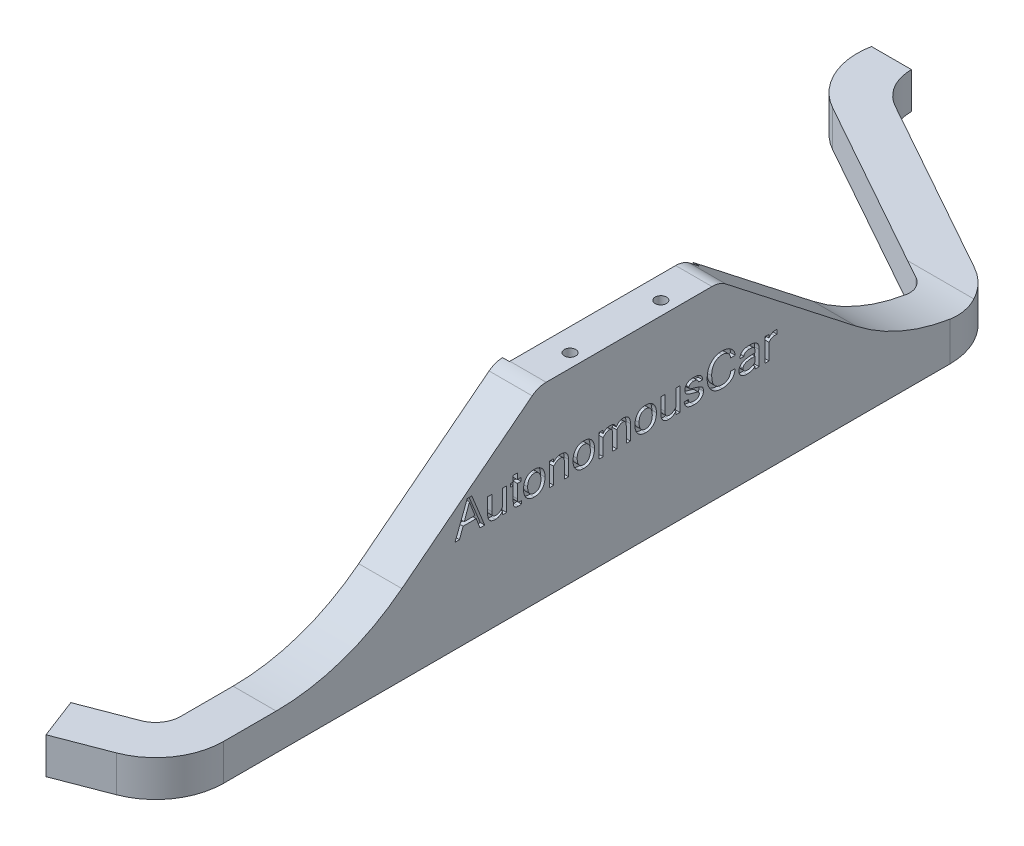
from build123d import *

# Parameters (mm, degrees)
BOSS_EXTRU_2_DEPTH      = 41
ENL_V_START             = -61.496999
ENL_V_MAT_EXTRU_1_DEPTH = 61.496999
ESQUISSE3_R             = 1.25
ENL_V_MAT_EXTRU_2_DEPTH = 5
ENL_V_MAT_EXTRU_4_REACH = 145.004
ESQUISSE5_W             = 1.5
ESQUISSE5_H             = 42
ESQUISSE4_R             = 1.25
ENL_V_MAT_EXTRU_3_DEPTH = 5
ENL_V_MAT_EXTRU_5_DEPTH = 1


with BuildPart() as part:
    # Esquisse1 → Boss.-Extru.2 (new body)
    with BuildSketch(Plane(origin=(0, 0, 0), x_dir=(1, 0, 0), z_dir=(0, 1, 0))):
        with BuildLine():
            Line((50.763559857, -98.740960781), (61.966654671, -94.440883272))
            ThreePointArc((61.966654671, -94.440883272), (64.531491929, -92.419022685), (65.5, -89.3))
            Line((65.5, -89.3), (65.5, 70.7))
            ThreePointArc((65.5, 70.7), (64.743593506, 73.483580545), (62.682428855, 75.501518035))
            Line((62.682428855, 75.501518035), (21.187286271, 98.683304924))
            ThreePointArc((21.187286271, 98.683304924), (14.89615211, 105.465379036), (13.780150118, 114.648485147))
            Line((13.780150118, 114.648485147), (22.592211018, 114.648485147))
            ThreePointArc((22.592211018, 114.648485147), (23.967495552, 109.587429612), (27.715067645, 105.918452357))
            Line((27.715067645, 105.918452357), (67.31571506, 83.795049185))
            ThreePointArc((67.31571506, 83.795049185), (72.937073199, 78.291583303), (75, 70.7))
            Line((75, 70.7), (75, -89.3))
            ThreePointArc((75, -89.3), (72.360609576, -97.8), (65.370882699, -103.31))
            Line((65.370882699, -103.31), (54.167787884, -107.610077509))
            Line((54.167787884, -107.610077509), (50.763559857, -98.740960781))
        make_face()
    extrude(amount=BOSS_EXTRU_2_DEPTH)

    # Esquisse2 → Enlèv. mat.-Extru.1 (cut)
    with BuildSketch(Plane(origin=(75, 0, 0), x_dir=(0, 0, -1), z_dir=(1, 0, 0)).offset(ENL_V_START)):
        with BuildLine():
            Line((-107.610077509, 8), (-77.729988546, 8))
            ThreePointArc((-77.729988546, 8), (-63.08996569, 10.448034936), (-50.042800053, 17.525789743))
            Line((-50.042800053, 17.525789743), (-21.322570174, 39.941578917))
            ThreePointArc((-21.322570174, 39.941578917), (-19.872885103, 40.727996118), (-18.246215897, 41))
            Line((-18.246215897, 41), (18.279747735, 41))
            ThreePointArc((18.279747735, 41), (19.906416941, 40.727996118), (21.356102012, 39.941578917))
            Line((21.356102012, 39.941578917), (50.076331892, 17.525789743))
            ThreePointArc((50.076331892, 17.525789743), (63.123497529, 10.448034936), (77.763520385, 8))
            Line((77.763520385, 8), (114.648485147, 8))
            Line((114.648485147, 8), (114.648485147, 51.491997176))
            Line((114.648485147, 51.491997176), (-107.610077509, 51.491997176))
            Line((-107.610077509, 51.491997176), (-107.610077509, 8))
        make_face()
    extrude(amount=ENL_V_MAT_EXTRU_1_DEPTH, mode=Mode.SUBTRACT)

    # Esquisse3 → Enlèv. mat.-Extru.2 (cut)
    with BuildSketch(Plane.XZ):
        with Locations(Location((72, 11.001514853, 0), (0, 0, 270))):
            Circle(ESQUISSE3_R)
        with Locations(Location((72, -39.078485147, 0), (0, 0, 270))):
            Circle(ESQUISSE3_R)
        with Locations(Location((63.03, 98.921514853, 0), (0, 0, 270))):
            Circle(ESQUISSE3_R)
        with Locations(Location((65.848788278, -79.175234258, 0), (0, 0, 270))):
            Circle(ESQUISSE3_R)
        with Locations(Location((26.642211018, -101.078485147, 0), (0, 0, 270))):
            Circle(ESQUISSE3_R)
        with Locations(Location((72, 61.081514853, 0), (0, 0, 270))):
            Circle(ESQUISSE3_R)
    extrude(amount=-ENL_V_MAT_EXTRU_2_DEPTH, mode=Mode.SUBTRACT)

    # Enlèv. mat.-Extru.4: up to this face of the body (flat: up to its plane)
    enl_v_mat_extru_4_end = Plane(part.part.faces().sort_by_distance((70.25, 41, -0.016765919))[0])
    # Esquisse5 → Enlèv. mat.-Extru.4 (cut, up to the picked face)
    with BuildSketch(Plane.XZ, mode=Mode.PRIVATE) as enl_v_mat_extru_4_sk1:
        with Locations((66.25, -2.648485147)):
            Rectangle(ESQUISSE5_W, ESQUISSE5_H)
    enl_v_mat_extru_4_tool1 = split(extrude(enl_v_mat_extru_4_sk1.sketch, amount=-ENL_V_MAT_EXTRU_4_REACH, mode=Mode.PRIVATE), bisect_by=enl_v_mat_extru_4_end, keep=Keep.BOTH, mode=Mode.PRIVATE)
    add(enl_v_mat_extru_4_tool1.solids().sort_by(Axis((66.25, 0, -2.648485), (0, 1, 0)))[0], mode=Mode.SUBTRACT)

    # Esquisse4 → Enlèv. mat.-Extru.3 (cut)
    with BuildSketch(Plane(origin=(0, 41, 0), x_dir=(1, 0, 0), z_dir=(0, 1, 0))):
        with Locations(Location((72, 10.016765919, 0), (0, 0, 270))):
            Circle(ESQUISSE4_R)
        with Locations(Location((72, -9.983234081, 0), (0, 0, 90))):
            Circle(ESQUISSE4_R)
    extrude(amount=-ENL_V_MAT_EXTRU_3_DEPTH, mode=Mode.SUBTRACT)

    # Esquisse7 → Enlèv. mat.-Extru.5 (cut)
    # profile 1 of 13: a face of its own
    with BuildSketch(Plane(origin=(75, 0, 0), x_dir=(0, 0, -1), z_dir=(1, 0, 0))):
        Polygon((-31.777547707, 20.5), (-32.828684071, 20.5), (-33.656809071, 22.681818182), (-36.555956798, 22.681818182), (-37.341468162, 20.5), (-38.323002252, 20.5), (-35.632661343, 27.5), (-34.634081798, 27.5), align=None)
        Polygon((-33.930956798, 23.409090909), (-35.14402498, 26.606534091), (-36.294593162, 23.409090909), align=None, mode=Mode.SUBTRACT)
    # profile 2 of 13: a face of its own
    with BuildSketch(Plane(origin=(75, 0, 0), x_dir=(0, 0, -1), z_dir=(1, 0, 0))):
        with BuildLine():
            add(Edge.make_bspline(
                [(-27.868456798, 21.171875), (-27.925128165, 21.111107173), (-28.035633549, 20.992613966), (-28.215593571, 20.837728714), (-28.399901536, 20.705758003), (-28.588986373, 20.596313907), (-28.785501819, 20.513639299), (-28.986510447, 20.454158924), (-29.192677339, 20.414718249), (-29.332292665, 20.410974686), (-29.402547707, 20.409090909)],
                knots=[0, 0, 0, 0, 1.127828388, 2.199190093, 3.218086356, 4.203140575, 5.159827852, 6.105909572, 7.046885413, 8, 8, 8, 8], degree=3))
            add(Edge.make_bspline(
                [(-29.402547707, 20.409090909), (-29.472701093, 20.41019445), (-29.609139026, 20.412340673), (-29.806543574, 20.436351193), (-29.990931329, 20.470415644), (-30.16157157, 20.521673499), (-30.318055654, 20.589205739), (-30.463234951, 20.668035048), (-30.593109645, 20.76419223), (-30.709691657, 20.874745181), (-30.811648331, 21.000190272), (-30.901063025, 21.139442754), (-30.974662991, 21.294438415), (-31.035048056, 21.463565137), (-31.083946042, 21.646811827), (-31.117353391, 21.845088905), (-31.136982907, 22.057839578), (-31.139758511, 22.204502826), (-31.141184071, 22.279829545)],
                knots=[0, 0, 0, 0, 1.149030253, 2.23469346, 3.254265501, 4.218948563, 5.147116777, 6.043205733, 6.920039969, 7.787208019, 8.669450004, 9.562712599, 10.492792392, 11.474580383, 12.502210548, 13.596710759, 14.765662847, 16, 16, 16, 16], degree=3))
            Line((-31.141184071, 22.279829545), (-31.141184071, 25.590909091))
            Line((-31.141184071, 25.590909091), (-30.232093162, 25.590909091))
            Line((-30.232093162, 25.590909091), (-30.232093162, 22.305397727))
            add(Edge.make_bspline(
                [(-30.232093162, 22.305397727), (-30.23188718, 22.255175928), (-30.231490164, 22.158376495), (-30.218946958, 22.018619986), (-30.203139232, 21.889864126), (-30.178813744, 21.772077364), (-30.147683737, 21.665115704), (-30.110223774, 21.568477183), (-30.064022453, 21.483309068), (-30.011290098, 21.40870429), (-29.95060024, 21.34315897), (-29.880084839, 21.287358713), (-29.800004758, 21.240656847), (-29.711264955, 21.202231764), (-29.614037158, 21.172527131), (-29.507946767, 21.151390174), (-29.392446269, 21.13856742), (-29.312146835, 21.137116917), (-29.270445434, 21.136363636)],
                knots=[0, 0, 0, 0, 1.373336941, 2.647022626, 3.836014541, 4.920805023, 5.933267669, 6.881014996, 7.750458455, 8.577164573, 9.374527885, 10.185764868, 11.027755585, 11.903736305, 12.825636, 13.803704939, 14.859411894, 16, 16, 16, 16], degree=3))
            add(Edge.make_bspline(
                [(-29.270445434, 21.136363636), (-29.207288968, 21.138849429), (-29.080763147, 21.143829394), (-28.893716866, 21.183486664), (-28.711553594, 21.248928606), (-28.532329063, 21.337131469), (-28.359171231, 21.454010551), (-28.188797496, 21.59465979), (-28.022733105, 21.760664355), (-27.920861096, 21.885874401), (-27.868456798, 21.950284091)],
                knots=[0, 0, 0, 0, 0.901713362, 1.806466215, 2.717870271, 3.661706435, 4.65228247, 5.695064889, 6.814311147, 8, 8, 8, 8], degree=3))
            Line((-27.868456798, 21.950284091), (-27.868456798, 25.590909091))
            Line((-27.868456798, 25.590909091), (-26.959365889, 25.590909091))
            Line((-26.959365889, 25.590909091), (-26.959365889, 20.5))
            Line((-26.959365889, 20.5), (-27.868456798, 20.5))
            Line((-27.868456798, 20.5), (-27.868456798, 21.171875))
        make_face()
    # profile 3 of 13: a face of its own
    with BuildSketch(Plane(origin=(75, 0, 0), x_dir=(0, 0, -1), z_dir=(1, 0, 0))):
        with BuildLine():
            add(Edge.make_bspline(
                [(-23.686638616, 20.46875), (-23.788211897, 20.451702758), (-23.999324003, 20.416271401), (-24.213364461, 20.411543865), (-24.324422707, 20.409090909)],
                knots=[0, 0, 0, 0, 0.962268651, 2, 2, 2, 2], degree=3))
            add(Edge.make_bspline(
                [(-24.324422707, 20.409090909), (-24.368478314, 20.409472288), (-24.45387086, 20.41021151), (-24.577157317, 20.420511601), (-24.691441205, 20.436060844), (-24.796695961, 20.456485682), (-24.892509686, 20.485316108), (-24.979497764, 20.519380192), (-25.058498564, 20.558374577), (-25.148050344, 20.621130725), (-25.244512177, 20.710573252), (-25.338017162, 20.833326093), (-25.406380646, 20.971293442), (-25.448144696, 21.125874883), (-25.473522922, 21.29999547), (-25.491191916, 21.498746282), (-25.502440278, 21.725252476), (-25.503996642, 21.885402246), (-25.504820434, 21.970170455)],
                knots=[0, 0, 0, 0, 0.915506075, 1.774516358, 2.569274487, 3.312384989, 4.000542567, 4.64569235, 5.253104346, 5.826388329, 6.91283513, 7.973796641, 9.01694262, 10.091691676, 11.287428953, 12.671219085, 14.238056834, 16, 16, 16, 16], degree=3))
            Line((-25.504820434, 21.970170455), (-25.504820434, 24.863636364))
            Line((-25.504820434, 24.863636364), (-26.141184071, 24.863636364))
            Line((-26.141184071, 24.863636364), (-26.141184071, 25.590909091))
            Line((-26.141184071, 25.590909091), (-25.504820434, 25.590909091))
            Line((-25.504820434, 25.590909091), (-25.504820434, 26.863636364))
            Line((-25.504820434, 26.863636364), (-24.595729525, 26.863636364))
            Line((-24.595729525, 26.863636364), (-24.595729525, 25.590909091))
            Line((-24.595729525, 25.590909091), (-23.777547707, 25.590909091))
            Line((-23.777547707, 25.590909091), (-23.777547707, 24.863636364))
            Line((-23.777547707, 24.863636364), (-24.595729525, 24.863636364))
            Line((-24.595729525, 24.863636364), (-24.595729525, 21.938920455))
            add(Edge.make_bspline(
                [(-24.595729525, 21.938920455), (-24.59577158, 21.89723895), (-24.595851461, 21.818066373), (-24.588003718, 21.705332678), (-24.578226578, 21.604917392), (-24.566717774, 21.515780834), (-24.547540569, 21.43917578), (-24.527404382, 21.373417695), (-24.501892794, 21.319490272), (-24.462189728, 21.26472458), (-24.401303885, 21.212845015), (-24.317708378, 21.168703926), (-24.222542912, 21.140097249), (-24.155131598, 21.137645721), (-24.119877252, 21.136363636)],
                knots=[0, 0, 0, 0, 1.398848829, 2.657065015, 3.791080445, 4.786898287, 5.669749782, 6.438810766, 7.092827035, 7.661947346, 8.698173471, 9.743502783, 10.819911231, 12, 12, 12, 12], degree=3))
            add(Edge.make_bspline(
                [(-24.119877252, 21.136363636), (-24.045865127, 21.138016578), (-23.900599646, 21.141260849), (-23.757050233, 21.163706311), (-23.686638616, 21.174715909)],
                knots=[0, 0, 0, 0, 1.018991225, 2, 2, 2, 2], degree=3))
            Line((-23.686638616, 21.174715909), (-23.686638616, 20.46875))
        make_face()
    # profile 4 of 13: a face of its own
    with BuildSketch(Plane(origin=(75, 0, 0), x_dir=(0, 0, -1), z_dir=(1, 0, 0))):
        with BuildLine():
            add(Edge.make_bspline(
                [(-20.871297707, 25.681818182), (-20.783618239, 25.679459525), (-20.611954133, 25.674841604), (-20.361088523, 25.643898891), (-20.124118439, 25.589885689), (-19.90093326, 25.514097318), (-19.690547304, 25.417897466), (-19.495494825, 25.296831807), (-19.311824995, 25.157523512), (-19.144486148, 24.99501663), (-18.993797968, 24.813201342), (-18.862503236, 24.613015071), (-18.751197811, 24.395395205), (-18.659793626, 24.159908426), (-18.591597333, 23.905758339), (-18.539796702, 23.634814174), (-18.510309923, 23.345825329), (-18.506682084, 23.147319279), (-18.504820434, 23.045454545)],
                knots=[0, 0, 0, 0, 1.049034325, 2.05386214, 3.018604366, 3.951981618, 4.869545413, 5.779945843, 6.693214847, 7.622715751, 8.564223993, 9.513269582, 10.481133853, 11.48373939, 12.529648482, 13.62517997, 14.7813449, 16, 16, 16, 16], degree=3))
            add(Edge.make_bspline(
                [(-18.504820434, 23.045454545), (-18.506656393, 22.943586805), (-18.510225677, 22.745545921), (-18.539960245, 22.457065049), (-18.591368701, 22.186986963), (-18.660008913, 21.93341235), (-18.75155446, 21.698073574), (-18.862079941, 21.479562761), (-18.993870665, 21.279185932), (-19.144384724, 21.097186605), (-19.312360243, 20.935043976), (-19.494582495, 20.793707157), (-19.691024772, 20.674668203), (-19.901149953, 20.578500911), (-20.123827207, 20.500615814), (-20.361128389, 20.447134921), (-20.611943477, 20.416034149), (-20.783614637, 20.411438296), (-20.871297707, 20.409090909)],
                knots=[0, 0, 0, 0, 1.218937572, 2.369734242, 3.465519663, 4.50620902, 5.509046951, 6.482180439, 7.431446007, 8.373172481, 9.302888835, 10.219825273, 11.127487668, 12.045264145, 12.980695951, 13.945661796, 14.950722519, 16, 16, 16, 16], degree=3))
            add(Edge.make_bspline(
                [(-20.871297707, 20.409090909), (-20.958506593, 20.411441455), (-21.129232662, 20.416043044), (-21.37865236, 20.447091794), (-21.61491948, 20.500856219), (-21.837204137, 20.578460205), (-22.047253514, 20.674744111), (-22.243632542, 20.793251495), (-22.424632136, 20.935550917), (-22.592581135, 21.097119048), (-22.743028738, 21.279204277), (-22.874837573, 21.479557696), (-22.98535804, 21.69807499), (-23.076904992, 21.93341195), (-23.145544806, 22.186987078), (-23.196953376, 22.457065016), (-23.226687912, 22.74554593), (-23.230257201, 22.943586808), (-23.232093162, 23.045454545)],
                knots=[0, 0, 0, 0, 1.045006319, 2.045775724, 3.006496687, 3.943174395, 4.862173258, 5.771044569, 6.684720645, 7.615675288, 8.558656048, 9.509185943, 10.483615548, 11.487789159, 12.529864611, 13.627109509, 14.779438925, 16, 16, 16, 16], degree=3))
            add(Edge.make_bspline(
                [(-23.232093162, 23.045454545), (-23.230231509, 23.147319276), (-23.226603666, 23.34582532), (-23.19711692, 23.634814207), (-23.145316175, 23.905758224), (-23.077120277, 24.159908828), (-22.985714703, 24.395393793), (-22.874414213, 24.613020104), (-22.74310159, 24.813183001), (-22.592479133, 24.995084157), (-22.425170127, 25.157015174), (-22.242719274, 25.29729146), (-22.047731507, 25.417821525), (-21.837420721, 25.514138235), (-21.614629229, 25.589648257), (-21.378691883, 25.643940988), (-21.129222094, 25.674832975), (-20.95850302, 25.679456454), (-20.871297707, 25.681818182)],
                knots=[0, 0, 0, 0, 1.220279149, 2.377984851, 3.474976307, 4.522279238, 5.526220904, 6.495375006, 7.445685348, 8.388448298, 9.319187909, 10.229176357, 11.140790039, 12.059576632, 12.994197755, 13.95469681, 14.955235057, 16, 16, 16, 16], degree=3))
        make_face()
        with BuildLine():
            add(Edge.make_bspline(
                [(-20.868456798, 21.136363636), (-20.815815304, 21.137571292), (-20.712385605, 21.139944087), (-20.560875387, 21.163316899), (-20.417064793, 21.201541072), (-20.280958504, 21.254718178), (-20.15213507, 21.321299506), (-20.031841318, 21.404868844), (-19.919650333, 21.503672976), (-19.81387605, 21.615985599), (-19.718406702, 21.743549163), (-19.63778868, 21.887499863), (-19.567777134, 22.044216378), (-19.511080907, 22.216041725), (-19.467383386, 22.40242758), (-19.437184304, 22.603400285), (-19.416088958, 22.818208776), (-19.414651621, 22.96632749), (-19.413911343, 23.042613636)],
                knots=[0, 0, 0, 0, 0.932839246, 1.832837115, 2.710552587, 3.566476241, 4.418892928, 5.275886436, 6.156488082, 7.0652537, 8.007228511, 8.973580228, 9.984560426, 11.046509435, 12.17668714, 13.37476731, 14.647916404, 16, 16, 16, 16], degree=3))
            add(Edge.make_bspline(
                [(-19.413911343, 23.042613636), (-19.414648045, 23.119373931), (-19.416078686, 23.268439042), (-19.437233349, 23.484651129), (-19.467169704, 23.686631094), (-19.511376175, 23.873823733), (-19.567457381, 24.046325824), (-19.637822153, 24.20339915), (-19.718399649, 24.347359462), (-19.813872439, 24.474934522), (-19.919670398, 24.587194679), (-20.031767872, 24.686188663), (-20.152583705, 24.769198048), (-20.280214597, 24.838308445), (-20.417464128, 24.888842048), (-20.560810265, 24.927750113), (-20.712402757, 24.950923411), (-20.81582109, 24.95332377), (-20.868456798, 24.954545455)],
                knots=[0, 0, 0, 0, 1.357598019, 2.636395568, 3.840219106, 4.968005622, 6.035658851, 7.044500053, 8.008807198, 8.948789013, 9.855631897, 10.734370398, 11.589550711, 12.444074203, 13.295182303, 14.171040735, 15.069134422, 16, 16, 16, 16], degree=3))
            add(Edge.make_bspline(
                [(-20.868456798, 24.954545455), (-20.921092506, 24.95332377), (-21.024510839, 24.950923411), (-21.176103331, 24.927750113), (-21.319449468, 24.888842048), (-21.456698999, 24.838308445), (-21.584329891, 24.769198048), (-21.705145724, 24.686188663), (-21.817243198, 24.587194679), (-21.923041157, 24.474934522), (-22.018513947, 24.347359462), (-22.099091443, 24.20339915), (-22.169456214, 24.046325824), (-22.225537421, 23.873823733), (-22.269743892, 23.686631094), (-22.299680247, 23.484651129), (-22.320834909, 23.268439042), (-22.322265551, 23.119373931), (-22.323002252, 23.042613636)],
                knots=[0, 0, 0, 0, 0.930865578, 1.828959265, 2.704817697, 3.555925797, 4.410449289, 5.265629602, 6.144368103, 7.051210987, 7.991192802, 8.955499947, 9.964341149, 11.031994378, 12.159780894, 13.363604432, 14.642401981, 16, 16, 16, 16], degree=3))
            add(Edge.make_bspline(
                [(-22.323002252, 23.042613636), (-22.322261975, 22.96632749), (-22.320824638, 22.818208776), (-22.299729291, 22.603400285), (-22.26953021, 22.40242758), (-22.225832689, 22.216041725), (-22.169136462, 22.044216378), (-22.099124916, 21.887499863), (-22.018506894, 21.743549163), (-21.923037546, 21.615985599), (-21.817263263, 21.503672976), (-21.705072278, 21.404868844), (-21.584778526, 21.321299506), (-21.455955092, 21.254718178), (-21.319848803, 21.201541072), (-21.176038208, 21.163316899), (-21.024527991, 21.139944087), (-20.921098291, 21.137571292), (-20.868456798, 21.136363636)],
                knots=[0, 0, 0, 0, 1.352083596, 2.62523269, 3.82331286, 4.953490565, 6.015439574, 7.026419772, 7.992771489, 8.9347463, 9.843511918, 10.724113564, 11.581107072, 12.433523759, 13.289447413, 14.167162885, 15.067160754, 16, 16, 16, 16], degree=3))
        make_face(mode=Mode.SUBTRACT)
    # profile 5 of 13: a face of its own
    with BuildSketch(Plane(origin=(75, 0, 0), x_dir=(0, 0, -1), z_dir=(1, 0, 0))):
        with BuildLine():
            add(Edge.make_bspline(
                [(-16.595729525, 24.921875), (-16.538998209, 24.982120762), (-16.428154701, 25.099830911), (-16.248512022, 25.254413097), (-16.064562325, 25.387470085), (-15.873557817, 25.493202012), (-15.678777487, 25.579407765), (-15.477749884, 25.638440396), (-15.271366482, 25.6757743), (-15.131873615, 25.679794168), (-15.061638616, 25.681818182)],
                knots=[0, 0, 0, 0, 1.124155824, 2.19641258, 3.216160061, 4.20447108, 5.158577312, 6.10544942, 7.04608915, 8, 8, 8, 8], degree=3))
            add(Edge.make_bspline(
                [(-15.061638616, 25.681818182), (-14.991485243, 25.680712923), (-14.855047335, 25.678563358), (-14.65764261, 25.654576365), (-14.472809236, 25.620347594), (-14.30234376, 25.569350346), (-14.145039197, 25.503370327), (-14.001405531, 25.422542492), (-13.870935433, 25.32689682), (-13.755062401, 25.216156031), (-13.651638734, 25.091873847), (-13.563456076, 24.951660344), (-13.49024308, 24.796547909), (-13.426585651, 24.62895216), (-13.380920306, 24.445197495), (-13.346737752, 24.247762304), (-13.327192541, 24.035427884), (-13.324427148, 23.889243406), (-13.323002252, 23.813920455)],
                knots=[0, 0, 0, 0, 1.149943122, 2.236468855, 3.256850915, 4.229735766, 5.148458424, 6.049050432, 6.926581285, 7.794438274, 8.671384828, 9.571909874, 10.502728587, 11.480682835, 12.507163291, 13.602533048, 14.764682204, 16, 16, 16, 16], degree=3))
            Line((-13.323002252, 23.813920455), (-13.323002252, 20.5))
            Line((-13.323002252, 20.5), (-14.232093162, 20.5))
            Line((-14.232093162, 20.5), (-14.232093162, 23.785511364))
            add(Edge.make_bspline(
                [(-14.232093162, 23.785511364), (-14.232283796, 23.835736316), (-14.232651232, 23.932541827), (-14.24539944, 24.072256214), (-14.260521854, 24.201253487), (-14.287183984, 24.318661753), (-14.317946676, 24.425740011), (-14.355039175, 24.52289907), (-14.403324047, 24.607130866), (-14.455558411, 24.682781504), (-14.517904335, 24.747261433), (-14.588275608, 24.803629244), (-14.668466797, 24.850234406), (-14.757179433, 24.888664352), (-14.854841773, 24.918595338), (-14.961483034, 24.939346249), (-15.076944096, 24.952322196), (-15.156772825, 24.953788267), (-15.198002252, 24.954545455)],
                knots=[0, 0, 0, 0, 1.371827898, 2.644114037, 3.83179947, 4.918098577, 5.929448714, 6.876154642, 7.750885757, 8.576683478, 9.382055027, 10.19240061, 11.033466135, 11.908484314, 12.829371012, 13.819050132, 14.87359706, 16, 16, 16, 16], degree=3))
            add(Edge.make_bspline(
                [(-15.198002252, 24.954545455), (-15.256442627, 24.952037378), (-15.374555275, 24.946968356), (-15.550959525, 24.906460982), (-15.726474792, 24.841470458), (-15.902919634, 24.75278574), (-16.077159974, 24.635921589), (-16.253079867, 24.495959397), (-16.427378321, 24.329050745), (-16.53833621, 24.204862011), (-16.595729525, 24.140625)],
                knots=[0, 0, 0, 0, 0.840281211, 1.698275214, 2.590640667, 3.529127209, 4.532563541, 5.604079008, 6.760702381, 8, 8, 8, 8], degree=3))
            Line((-16.595729525, 24.140625), (-16.595729525, 20.5))
            Line((-16.595729525, 20.5), (-17.504820434, 20.5))
            Line((-17.504820434, 20.5), (-17.504820434, 25.590909091))
            Line((-17.504820434, 25.590909091), (-16.595729525, 25.590909091))
            Line((-16.595729525, 25.590909091), (-16.595729525, 24.921875))
        make_face()
    # profile 6 of 13: a face of its own
    with BuildSketch(Plane(origin=(75, 0, 0), x_dir=(0, 0, -1), z_dir=(1, 0, 0))):
        with BuildLine():
            add(Edge.make_bspline(
                [(-9.962206798, 25.681818182), (-9.87452733, 25.679459525), (-9.702863224, 25.674841604), (-9.451997614, 25.643898891), (-9.215027529, 25.589885689), (-8.991842351, 25.514097318), (-8.781456394, 25.417897466), (-8.586403915, 25.296831807), (-8.402734086, 25.157523512), (-8.235395239, 24.99501663), (-8.084707059, 24.813201342), (-7.953412327, 24.613015071), (-7.842106902, 24.395395205), (-7.750702717, 24.159908426), (-7.682506424, 23.905758339), (-7.630705793, 23.634814174), (-7.601219014, 23.345825329), (-7.597591175, 23.147319279), (-7.595729525, 23.045454545)],
                knots=[0, 0, 0, 0, 1.049034325, 2.05386214, 3.018604366, 3.951981618, 4.869545413, 5.779945843, 6.693214847, 7.622715751, 8.564223993, 9.513269582, 10.481133853, 11.48373939, 12.529648482, 13.62517997, 14.7813449, 16, 16, 16, 16], degree=3))
            add(Edge.make_bspline(
                [(-7.595729525, 23.045454545), (-7.597565484, 22.943586805), (-7.601134768, 22.745545921), (-7.630869336, 22.457065049), (-7.682277792, 22.186986963), (-7.750918004, 21.93341235), (-7.842463551, 21.698073574), (-7.952989032, 21.479562761), (-8.084779756, 21.279185932), (-8.235293815, 21.097186605), (-8.403269334, 20.935043976), (-8.585491586, 20.793707157), (-8.781933862, 20.674668203), (-8.992059044, 20.578500911), (-9.214736298, 20.500615814), (-9.45203748, 20.447134921), (-9.702852568, 20.416034149), (-9.874523727, 20.411438296), (-9.962206798, 20.409090909)],
                knots=[0, 0, 0, 0, 1.218937572, 2.369734242, 3.465519663, 4.50620902, 5.509046951, 6.482180439, 7.431446007, 8.373172481, 9.302888835, 10.219825273, 11.127487668, 12.045264145, 12.980695951, 13.945661796, 14.950722519, 16, 16, 16, 16], degree=3))
            add(Edge.make_bspline(
                [(-9.962206798, 20.409090909), (-10.049415683, 20.411441455), (-10.220141752, 20.416043044), (-10.469561451, 20.447091794), (-10.705828571, 20.500856219), (-10.928113228, 20.578460205), (-11.138162605, 20.674744111), (-11.334541633, 20.793251495), (-11.515541227, 20.935550917), (-11.683490226, 21.097119048), (-11.833937829, 21.279204277), (-11.965746664, 21.479557696), (-12.076267131, 21.69807499), (-12.167814083, 21.93341195), (-12.236453897, 22.186987078), (-12.287862467, 22.457065016), (-12.317597003, 22.74554593), (-12.321166291, 22.943586808), (-12.323002252, 23.045454545)],
                knots=[0, 0, 0, 0, 1.045006319, 2.045775724, 3.006496687, 3.943174395, 4.862173258, 5.771044569, 6.684720645, 7.615675288, 8.558656048, 9.509185943, 10.483615548, 11.487789159, 12.529864611, 13.627109509, 14.779438925, 16, 16, 16, 16], degree=3))
            add(Edge.make_bspline(
                [(-12.323002252, 23.045454545), (-12.3211406, 23.147319276), (-12.317512757, 23.34582532), (-12.28802601, 23.634814207), (-12.236225265, 23.905758224), (-12.168029368, 24.159908828), (-12.076623794, 24.395393793), (-11.965323303, 24.613020104), (-11.834010681, 24.813183001), (-11.683388224, 24.995084157), (-11.516079218, 25.157015174), (-11.333628365, 25.29729146), (-11.138640598, 25.417821525), (-10.928329812, 25.514138235), (-10.70553832, 25.589648257), (-10.469600974, 25.643940988), (-10.220131185, 25.674832975), (-10.049412111, 25.679456454), (-9.962206798, 25.681818182)],
                knots=[0, 0, 0, 0, 1.220279149, 2.377984851, 3.474976307, 4.522279238, 5.526220904, 6.495375006, 7.445685348, 8.388448298, 9.319187909, 10.229176357, 11.140790039, 12.059576632, 12.994197755, 13.95469681, 14.955235057, 16, 16, 16, 16], degree=3))
        make_face()
        with BuildLine():
            add(Edge.make_bspline(
                [(-9.959365889, 21.136363636), (-9.906724395, 21.137571292), (-9.803294696, 21.139944087), (-9.651784478, 21.163316899), (-9.507973884, 21.201541072), (-9.371867595, 21.254718178), (-9.243044161, 21.321299506), (-9.122750408, 21.404868844), (-9.010559423, 21.503672976), (-8.904785141, 21.615985599), (-8.809315793, 21.743549163), (-8.728697771, 21.887499863), (-8.658686225, 22.044216378), (-8.601989998, 22.216041725), (-8.558292477, 22.40242758), (-8.528093395, 22.603400285), (-8.506998049, 22.818208776), (-8.505560711, 22.96632749), (-8.504820434, 23.042613636)],
                knots=[0, 0, 0, 0, 0.932839246, 1.832837115, 2.710552587, 3.566476241, 4.418892928, 5.275886436, 6.156488082, 7.0652537, 8.007228511, 8.973580228, 9.984560426, 11.046509435, 12.17668714, 13.37476731, 14.647916404, 16, 16, 16, 16], degree=3))
            add(Edge.make_bspline(
                [(-8.504820434, 23.042613636), (-8.505557136, 23.119373931), (-8.506987777, 23.268439042), (-8.52814244, 23.484651129), (-8.558078795, 23.686631094), (-8.602285266, 23.873823733), (-8.658366472, 24.046325824), (-8.728731244, 24.20339915), (-8.80930874, 24.347359462), (-8.90478153, 24.474934522), (-9.010579489, 24.587194679), (-9.122676963, 24.686188663), (-9.243492796, 24.769198048), (-9.371123688, 24.838308445), (-9.508373218, 24.888842048), (-9.651719356, 24.927750113), (-9.803311848, 24.950923411), (-9.906730181, 24.95332377), (-9.959365889, 24.954545455)],
                knots=[0, 0, 0, 0, 1.357598019, 2.636395568, 3.840219106, 4.968005622, 6.035658851, 7.044500053, 8.008807198, 8.948789013, 9.855631897, 10.734370398, 11.589550711, 12.444074203, 13.295182303, 14.171040735, 15.069134422, 16, 16, 16, 16], degree=3))
            add(Edge.make_bspline(
                [(-9.959365889, 24.954545455), (-10.012001597, 24.95332377), (-10.11541993, 24.950923411), (-10.267012422, 24.927750113), (-10.410358559, 24.888842048), (-10.54760809, 24.838308445), (-10.675238982, 24.769198048), (-10.796054815, 24.686188663), (-10.908152289, 24.587194679), (-11.013950248, 24.474934522), (-11.109423037, 24.347359462), (-11.190000534, 24.20339915), (-11.260365305, 24.046325824), (-11.316446512, 23.873823733), (-11.360652982, 23.686631094), (-11.390589338, 23.484651129), (-11.411744, 23.268439042), (-11.413174642, 23.119373931), (-11.413911343, 23.042613636)],
                knots=[0, 0, 0, 0, 0.930865578, 1.828959265, 2.704817697, 3.555925797, 4.410449289, 5.265629602, 6.144368103, 7.051210987, 7.991192802, 8.955499947, 9.964341149, 11.031994378, 12.159780894, 13.363604432, 14.642401981, 16, 16, 16, 16], degree=3))
            add(Edge.make_bspline(
                [(-11.413911343, 23.042613636), (-11.413171066, 22.96632749), (-11.411733729, 22.818208776), (-11.390638382, 22.603400285), (-11.360439301, 22.40242758), (-11.31674178, 22.216041725), (-11.260045553, 22.044216378), (-11.190034007, 21.887499863), (-11.109415985, 21.743549163), (-11.013946637, 21.615985599), (-10.908172354, 21.503672976), (-10.795981369, 21.404868844), (-10.675687617, 21.321299506), (-10.546864183, 21.254718178), (-10.410757894, 21.201541072), (-10.266947299, 21.163316899), (-10.115437082, 21.139944087), (-10.012007382, 21.137571292), (-9.959365889, 21.136363636)],
                knots=[0, 0, 0, 0, 1.352083596, 2.62523269, 3.82331286, 4.953490565, 6.015439574, 7.026419772, 7.992771489, 8.9347463, 9.843511918, 10.724113564, 11.581107072, 12.433523759, 13.289447413, 14.167162885, 15.067160754, 16, 16, 16, 16], degree=3))
        make_face(mode=Mode.SUBTRACT)
    # profile 7 of 13: a face of its own
    with BuildSketch(Plane(origin=(75, 0, 0), x_dir=(0, 0, -1), z_dir=(1, 0, 0))):
        with BuildLine():
            Line((0.313361384, 20.5), (-0.595729525, 20.5))
            Line((-0.595729525, 20.5), (-0.595729525, 23.785511364))
            add(Edge.make_bspline(
                [(-0.595729525, 23.785511364), (-0.596244003, 23.836186654), (-0.597240081, 23.934298916), (-0.605688708, 24.075559473), (-0.619607132, 24.205513265), (-0.63935265, 24.323653849), (-0.664354944, 24.431287224), (-0.696986901, 24.527063511), (-0.733683286, 24.612118381), (-0.776418625, 24.686168116), (-0.827548088, 24.749326543), (-0.883879211, 24.806091395), (-0.950923325, 24.850849342), (-1.023422196, 24.890644284), (-1.105526443, 24.917738963), (-1.193743713, 24.939505121), (-1.289963683, 24.952326625), (-1.356582012, 24.95378695), (-1.391184071, 24.954545455)],
                knots=[0, 0, 0, 0, 1.493935585, 2.892403697, 4.170372235, 5.345383876, 6.422082669, 7.424162481, 8.324203399, 9.150181051, 9.935027125, 10.714891579, 11.497126258, 12.302679702, 13.145935184, 14.036398611, 14.98009076, 16, 16, 16, 16], degree=3))
            add(Edge.make_bspline(
                [(-1.391184071, 24.954545455), (-1.446329388, 24.952067667), (-1.557462941, 24.947074217), (-1.723014771, 24.906274372), (-1.886895409, 24.841587782), (-2.050804203, 24.75227537), (-2.212104666, 24.635932758), (-2.373778882, 24.495278034), (-2.533874215, 24.328920438), (-2.634525204, 24.204859322), (-2.686638616, 24.140625)],
                knots=[0, 0, 0, 0, 0.835193023, 1.683152312, 2.569615213, 3.501144871, 4.505013219, 5.578725089, 6.746352143, 8, 8, 8, 8], degree=3))
            Line((-2.686638616, 24.140625), (-2.686638616, 20.5))
            Line((-2.686638616, 20.5), (-3.595729525, 20.5))
            Line((-3.595729525, 20.5), (-3.595729525, 23.785511364))
            add(Edge.make_bspline(
                [(-3.595729525, 23.785511364), (-3.596244002, 23.836186655), (-3.59724008, 23.934298917), (-3.60568871, 24.07555947), (-3.619607127, 24.205513275), (-3.639352668, 24.323653816), (-3.664354887, 24.431287332), (-3.696987089, 24.527063153), (-3.733682684, 24.612119528), (-3.776420632, 24.686164292), (-3.827541008, 24.74934003), (-3.883905533, 24.806041258), (-3.951172912, 24.851274493), (-4.024568962, 24.890271529), (-4.106911896, 24.91779783), (-4.195625312, 24.939642693), (-4.292813322, 24.952299646), (-4.360371582, 24.953777964), (-4.395445434, 24.954545455)],
                knots=[0, 0, 0, 0, 1.490196267, 2.885164016, 4.159933801, 5.33200439, 6.406008208, 7.405579816, 8.303367934, 9.127278165, 9.91015977, 10.688072226, 11.468348973, 12.284218556, 13.125363372, 14.01359797, 14.96873054, 16, 16, 16, 16], degree=3))
            add(Edge.make_bspline(
                [(-4.395445434, 24.954545455), (-4.45058987, 24.952066451), (-4.561721648, 24.94707055), (-4.727287155, 24.906289583), (-4.891112433, 24.841526582), (-5.054906129, 24.752708685), (-5.21500682, 24.635375815), (-5.3766231, 24.495766349), (-5.535220777, 24.328781738), (-5.634974702, 24.204824263), (-5.686638616, 24.140625)],
                knots=[0, 0, 0, 0, 0.836804897, 1.686400698, 2.574574421, 3.507901878, 4.507853353, 5.583637424, 6.748532952, 8, 8, 8, 8], degree=3))
            Line((-5.686638616, 24.140625), (-5.686638616, 20.5))
            Line((-5.686638616, 20.5), (-6.595729525, 20.5))
            Line((-6.595729525, 20.5), (-6.595729525, 25.590909091))
            Line((-6.595729525, 25.590909091), (-5.686638616, 25.590909091))
            Line((-5.686638616, 25.590909091), (-5.686638616, 24.921875))
            add(Edge.make_bspline(
                [(-5.686638616, 24.921875), (-5.633249304, 24.982089963), (-5.529135396, 25.099514496), (-5.359576076, 25.25369346), (-5.187220235, 25.386805842), (-5.00874274, 25.493031239), (-4.82713488, 25.57897762), (-4.639895637, 25.638425944), (-4.448067876, 25.675677513), (-4.318434803, 25.679766702), (-4.25339998, 25.681818182)],
                knots=[0, 0, 0, 0, 1.151393985, 2.245320666, 3.275716357, 4.26388374, 5.213153934, 6.145697202, 7.069726176, 8, 8, 8, 8], degree=3))
            add(Edge.make_bspline(
                [(-4.25339998, 25.681818182), (-4.163743736, 25.679300161), (-3.99184609, 25.674472368), (-3.746220341, 25.632186198), (-3.526663155, 25.559404616), (-3.330758069, 25.45999207), (-3.162198885, 25.327873913), (-3.017791463, 25.168226047), (-2.90144692, 24.977875195), (-2.847747995, 24.836719967), (-2.820161343, 24.764204545)],
                knots=[0, 0, 0, 0, 1.171614067, 2.246332142, 3.244689219, 4.186051071, 5.103603213, 6.028455869, 6.987162179, 8, 8, 8, 8], degree=3))
            add(Edge.make_bspline(
                [(-2.820161343, 24.764204545), (-2.778785999, 24.811812704), (-2.698732499, 24.903925525), (-2.578372351, 25.032766647), (-2.462896642, 25.148484284), (-2.352668335, 25.25116516), (-2.246204266, 25.339068876), (-2.145324015, 25.414051086), (-2.048518308, 25.473750461), (-1.92807782, 25.536186498), (-1.77945525, 25.591872784), (-1.60435053, 25.645052197), (-1.429672652, 25.675781555), (-1.313642306, 25.679820215), (-1.256240889, 25.681818182)],
                knots=[0, 0, 0, 0, 1.208135797, 2.33751524, 3.376454134, 4.339203868, 5.221759411, 6.019939149, 6.744829706, 7.397906675, 8.615604897, 9.777970306, 10.900738833, 12, 12, 12, 12], degree=3))
            add(Edge.make_bspline(
                [(-1.256240889, 25.681818182), (-1.192700981, 25.680747477), (-1.069446741, 25.678670533), (-0.891032383, 25.654267599), (-0.724283922, 25.620860282), (-0.570539658, 25.568043048), (-0.427794832, 25.504177573), (-0.298778951, 25.421540871), (-0.181543609, 25.3257467), (-0.075461818, 25.216408399), (0.015653253, 25.090103809), (0.097343917, 24.951458807), (0.163201083, 24.796201639), (0.219079979, 24.628197176), (0.260966242, 24.444951032), (0.292079396, 24.247572826), (0.310645384, 24.035394213), (0.312437691, 23.889242201), (0.313361384, 23.813920455)],
                knots=[0, 0, 0, 0, 1.09119232, 2.116686744, 3.090274014, 4.008954095, 4.904677686, 5.771586021, 6.63328443, 7.502328949, 8.38122346, 9.303787737, 10.262260052, 11.273579448, 12.343413727, 13.488614951, 14.705718062, 16, 16, 16, 16], degree=3))
            Line((0.313361384, 23.813920455), (0.313361384, 20.5))
        make_face()
    # profile 8 of 13: a face of its own
    with BuildSketch(Plane(origin=(75, 0, 0), x_dir=(0, 0, -1), z_dir=(1, 0, 0))):
        with BuildLine():
            add(Edge.make_bspline(
                [(3.674156838, 25.681818182), (3.761836306, 25.679459525), (3.933500412, 25.674841604), (4.184366022, 25.643898891), (4.421336107, 25.589885689), (4.644521285, 25.514097318), (4.854907242, 25.417897466), (5.049959721, 25.296831807), (5.23362955, 25.157523512), (5.400968397, 24.99501663), (5.551656577, 24.813201342), (5.68295131, 24.613015071), (5.794256734, 24.395395205), (5.885660919, 24.159908426), (5.953857212, 23.905758339), (6.005657844, 23.634814174), (6.035144623, 23.345825329), (6.038772461, 23.147319279), (6.040634111, 23.045454545)],
                knots=[0, 0, 0, 0, 1.049034325, 2.05386214, 3.018604366, 3.951981618, 4.869545413, 5.779945843, 6.693214847, 7.622715751, 8.564223993, 9.513269582, 10.481133853, 11.48373939, 12.529648482, 13.62517997, 14.7813449, 16, 16, 16, 16], degree=3))
            add(Edge.make_bspline(
                [(6.040634111, 23.045454545), (6.038798153, 22.943586805), (6.035228869, 22.745545921), (6.0054943, 22.457065049), (5.954085845, 22.186986963), (5.885445632, 21.93341235), (5.793900085, 21.698073574), (5.683374605, 21.479562761), (5.55158388, 21.279185932), (5.401069821, 21.097186605), (5.233094303, 20.935043976), (5.050872051, 20.793707157), (4.854429774, 20.674668203), (4.644304593, 20.578500911), (4.421627338, 20.500615814), (4.184326156, 20.447134921), (3.933511068, 20.416034149), (3.761839909, 20.411438296), (3.674156838, 20.409090909)],
                knots=[0, 0, 0, 0, 1.218937572, 2.369734242, 3.465519663, 4.50620902, 5.509046951, 6.482180439, 7.431446007, 8.373172481, 9.302888835, 10.219825273, 11.127487668, 12.045264145, 12.980695951, 13.945661796, 14.950722519, 16, 16, 16, 16], degree=3))
            add(Edge.make_bspline(
                [(3.674156838, 20.409090909), (3.586947953, 20.411441455), (3.416221884, 20.416043044), (3.166802185, 20.447091794), (2.930535065, 20.500856219), (2.708250409, 20.578460205), (2.498201031, 20.674744111), (2.301822003, 20.793251495), (2.120822409, 20.935550917), (1.952873411, 21.097119048), (1.802425807, 21.279204277), (1.670616972, 21.479557696), (1.560096505, 21.69807499), (1.468549554, 21.93341195), (1.399909739, 22.186987078), (1.348501169, 22.457065016), (1.318766633, 22.74554593), (1.315197345, 22.943586808), (1.313361384, 23.045454545)],
                knots=[0, 0, 0, 0, 1.045006319, 2.045775724, 3.006496687, 3.943174395, 4.862173258, 5.771044569, 6.684720645, 7.615675288, 8.558656048, 9.509185943, 10.483615548, 11.487789159, 12.529864611, 13.627109509, 14.779438925, 16, 16, 16, 16], degree=3))
            add(Edge.make_bspline(
                [(1.313361384, 23.045454545), (1.315223036, 23.147319276), (1.318850879, 23.34582532), (1.348337626, 23.634814207), (1.400138371, 23.905758224), (1.468334268, 24.159908828), (1.559739842, 24.395393793), (1.671040333, 24.613020104), (1.802352956, 24.813183001), (1.952975412, 24.995084157), (2.120284418, 25.157015174), (2.302735271, 25.29729146), (2.497723039, 25.417821525), (2.708033825, 25.514138235), (2.930825316, 25.589648257), (3.166762662, 25.643940988), (3.416232451, 25.674832975), (3.586951526, 25.679456454), (3.674156838, 25.681818182)],
                knots=[0, 0, 0, 0, 1.220279149, 2.377984851, 3.474976307, 4.522279238, 5.526220904, 6.495375006, 7.445685348, 8.388448298, 9.319187909, 10.229176357, 11.140790039, 12.059576632, 12.994197755, 13.95469681, 14.955235057, 16, 16, 16, 16], degree=3))
        make_face()
        with BuildLine():
            add(Edge.make_bspline(
                [(3.676997748, 21.136363636), (3.729639241, 21.137571292), (3.833068941, 21.139944087), (3.984579158, 21.163316899), (4.128389753, 21.201541072), (4.264496041, 21.254718178), (4.393319475, 21.321299506), (4.513613228, 21.404868844), (4.625804213, 21.503672976), (4.731578496, 21.615985599), (4.827047844, 21.743549163), (4.907665866, 21.887499863), (4.977677412, 22.044216378), (5.034373639, 22.216041725), (5.078071159, 22.40242758), (5.108270241, 22.603400285), (5.129365588, 22.818208776), (5.130802925, 22.96632749), (5.131543202, 23.042613636)],
                knots=[0, 0, 0, 0, 0.932839246, 1.832837115, 2.710552587, 3.566476241, 4.418892928, 5.275886436, 6.156488082, 7.0652537, 8.007228511, 8.973580228, 9.984560426, 11.046509435, 12.17668714, 13.37476731, 14.647916404, 16, 16, 16, 16], degree=3))
            add(Edge.make_bspline(
                [(5.131543202, 23.042613636), (5.130806501, 23.119373931), (5.129375859, 23.268439042), (5.108221196, 23.484651129), (5.078284841, 23.686631094), (5.034078371, 23.873823733), (4.977997164, 24.046325824), (4.907632393, 24.20339915), (4.827054896, 24.347359462), (4.731582106, 24.474934522), (4.625784148, 24.587194679), (4.513686674, 24.686188663), (4.392870841, 24.769198048), (4.265239949, 24.838308445), (4.127990418, 24.888842048), (3.984644281, 24.927750113), (3.833051789, 24.950923411), (3.729633456, 24.95332377), (3.676997748, 24.954545455)],
                knots=[0, 0, 0, 0, 1.357598019, 2.636395568, 3.840219106, 4.968005622, 6.035658851, 7.044500053, 8.008807198, 8.948789013, 9.855631897, 10.734370398, 11.589550711, 12.444074203, 13.295182303, 14.171040735, 15.069134422, 16, 16, 16, 16], degree=3))
            add(Edge.make_bspline(
                [(3.676997748, 24.954545455), (3.624362039, 24.95332377), (3.520943706, 24.950923411), (3.369351214, 24.927750113), (3.226005077, 24.888842048), (3.088755546, 24.838308445), (2.961124655, 24.769198048), (2.840308821, 24.686188663), (2.728211347, 24.587194679), (2.622413389, 24.474934522), (2.526940599, 24.347359462), (2.446363102, 24.20339915), (2.375998331, 24.046325824), (2.319917124, 23.873823733), (2.275710654, 23.686631094), (2.245774299, 23.484651129), (2.224619636, 23.268439042), (2.223188994, 23.119373931), (2.222452293, 23.042613636)],
                knots=[0, 0, 0, 0, 0.930865578, 1.828959265, 2.704817697, 3.555925797, 4.410449289, 5.265629602, 6.144368103, 7.051210987, 7.991192802, 8.955499947, 9.964341149, 11.031994378, 12.159780894, 13.363604432, 14.642401981, 16, 16, 16, 16], degree=3))
            add(Edge.make_bspline(
                [(2.222452293, 23.042613636), (2.22319257, 22.96632749), (2.224629907, 22.818208776), (2.245725254, 22.603400285), (2.275924336, 22.40242758), (2.319621856, 22.216041725), (2.376318084, 22.044216378), (2.446329629, 21.887499863), (2.526947651, 21.743549163), (2.622416999, 21.615985599), (2.728191282, 21.503672976), (2.840382267, 21.404868844), (2.96067602, 21.321299506), (3.089499454, 21.254718178), (3.225605743, 21.201541072), (3.369416337, 21.163316899), (3.520926555, 21.139944087), (3.624356254, 21.137571292), (3.676997748, 21.136363636)],
                knots=[0, 0, 0, 0, 1.352083596, 2.62523269, 3.82331286, 4.953490565, 6.015439574, 7.026419772, 7.992771489, 8.9347463, 9.843511918, 10.724113564, 11.581107072, 12.433523759, 13.289447413, 14.167162885, 15.067160754, 16, 16, 16, 16], degree=3))
        make_face(mode=Mode.SUBTRACT)
    # profile 9 of 13: a face of its own
    with BuildSketch(Plane(origin=(75, 0, 0), x_dir=(0, 0, -1), z_dir=(1, 0, 0))):
        with BuildLine():
            add(Edge.make_bspline(
                [(10.313361384, 21.171875), (10.256690017, 21.111107173), (10.146184633, 20.992613966), (9.966224611, 20.837728714), (9.781916646, 20.705758003), (9.592831809, 20.596313907), (9.396316363, 20.513639299), (9.195307735, 20.454158924), (8.989140843, 20.414718249), (8.849525517, 20.410974686), (8.779270475, 20.409090909)],
                knots=[0, 0, 0, 0, 1.127828388, 2.199190093, 3.218086356, 4.203140575, 5.159827852, 6.105909572, 7.046885413, 8, 8, 8, 8], degree=3))
            add(Edge.make_bspline(
                [(8.779270475, 20.409090909), (8.709117089, 20.41019445), (8.572679155, 20.412340673), (8.375274608, 20.436351193), (8.190886853, 20.470415644), (8.020246612, 20.521673499), (7.863762528, 20.589205739), (7.718583231, 20.668035048), (7.588708537, 20.76419223), (7.472126524, 20.874745181), (7.370169851, 21.000190272), (7.280755157, 21.139442754), (7.207155191, 21.294438415), (7.146770126, 21.463565137), (7.09787214, 21.646811827), (7.06446479, 21.845088905), (7.044835274, 22.057839578), (7.04205967, 22.204502826), (7.040634111, 22.279829545)],
                knots=[0, 0, 0, 0, 1.149030253, 2.23469346, 3.254265501, 4.218948563, 5.147116777, 6.043205733, 6.920039969, 7.787208019, 8.669450004, 9.562712599, 10.492792392, 11.474580383, 12.502210548, 13.596710759, 14.765662847, 16, 16, 16, 16], degree=3))
            Line((7.040634111, 22.279829545), (7.040634111, 25.590909091))
            Line((7.040634111, 25.590909091), (7.94972502, 25.590909091))
            Line((7.94972502, 25.590909091), (7.94972502, 22.305397727))
            add(Edge.make_bspline(
                [(7.94972502, 22.305397727), (7.949931001, 22.255175928), (7.950328018, 22.158376495), (7.962871223, 22.018619986), (7.97867895, 21.889864126), (8.003004438, 21.772077364), (8.034134445, 21.665115704), (8.071594407, 21.568477183), (8.117795728, 21.483309068), (8.170528083, 21.40870429), (8.231217941, 21.34315897), (8.301733342, 21.287358713), (8.381813423, 21.240656847), (8.470553226, 21.202231764), (8.567781023, 21.172527131), (8.673871415, 21.151390174), (8.789371913, 21.13856742), (8.869671347, 21.137116917), (8.911372748, 21.136363636)],
                knots=[0, 0, 0, 0, 1.373336941, 2.647022626, 3.836014541, 4.920805023, 5.933267669, 6.881014996, 7.750458455, 8.577164573, 9.374527885, 10.185764868, 11.027755585, 11.903736305, 12.825636, 13.803704939, 14.859411894, 16, 16, 16, 16], degree=3))
            add(Edge.make_bspline(
                [(8.911372748, 21.136363636), (8.974529214, 21.138849429), (9.101055035, 21.143829394), (9.288101316, 21.183486664), (9.470264587, 21.248928606), (9.649489119, 21.337131469), (9.822646951, 21.454010551), (9.993020686, 21.59465979), (10.159085076, 21.760664355), (10.260957086, 21.885874401), (10.313361384, 21.950284091)],
                knots=[0, 0, 0, 0, 0.901713362, 1.806466215, 2.717870271, 3.661706435, 4.65228247, 5.695064889, 6.814311147, 8, 8, 8, 8], degree=3))
            Line((10.313361384, 21.950284091), (10.313361384, 25.590909091))
            Line((10.313361384, 25.590909091), (11.222452293, 25.590909091))
            Line((11.222452293, 25.590909091), (11.222452293, 20.5))
            Line((11.222452293, 20.5), (10.313361384, 20.5))
            Line((10.313361384, 20.5), (10.313361384, 21.171875))
        make_face()
    # profile 10 of 13: a face of its own
    with BuildSketch(Plane(origin=(75, 0, 0), x_dir=(0, 0, -1), z_dir=(1, 0, 0))):
        with BuildLine():
            add(Edge.make_bspline(
                [(14.353134111, 20.409090909), (14.268357121, 20.410666667), (14.103806155, 20.413725192), (13.864515303, 20.431212477), (13.64132554, 20.464728361), (13.43314028, 20.506870893), (13.241877266, 20.566588683), (13.064365588, 20.634690812), (12.90378475, 20.719485735), (12.756751428, 20.81429285), (12.627580164, 20.924665135), (12.511909357, 21.046091421), (12.414315243, 21.181950741), (12.330570129, 21.329744702), (12.264472667, 21.490816718), (12.213012821, 21.664464559), (12.177420741, 21.850570766), (12.166804231, 21.979495648), (12.161372748, 22.045454545)],
                knots=[0, 0, 0, 0, 1.319282022, 2.560708178, 3.729738739, 4.829361201, 5.861772669, 6.844073443, 7.783238516, 8.682335094, 9.560573225, 10.42054363, 11.285580039, 12.156463574, 13.058122244, 13.988198455, 14.970747854, 16, 16, 16, 16], degree=3))
            Line((12.161372748, 22.045454545), (13.070463657, 22.045454545))
            add(Edge.make_bspline(
                [(13.070463657, 22.045454545), (13.071459121, 22.008915729), (13.073409715, 21.937318578), (13.091357537, 21.834197621), (13.116612602, 21.73733116), (13.152038538, 21.648191666), (13.19672091, 21.565286216), (13.251868042, 21.489878962), (13.318771567, 21.42323174), (13.392258292, 21.3609942), (13.478117742, 21.308635023), (13.5724111, 21.261632977), (13.677689909, 21.224038979), (13.790762027, 21.190665205), (13.914622085, 21.167610043), (14.047679964, 21.14836579), (14.191087826, 21.139508748), (14.289680834, 21.137431289), (14.34035002, 21.136363636)],
                knots=[0, 0, 0, 0, 0.988185029, 1.936330697, 2.825470949, 3.694146976, 4.525725737, 5.369072707, 6.211932615, 7.076723625, 7.969274972, 8.926472561, 9.92400488, 10.990840779, 12.114369753, 13.330567514, 14.628118026, 16, 16, 16, 16], degree=3))
            add(Edge.make_bspline(
                [(14.34035002, 21.136363636), (14.385839963, 21.136582381), (14.474135589, 21.137006963), (14.602514999, 21.149648721), (14.722771332, 21.165461458), (14.834757536, 21.190088676), (14.938179262, 21.220516874), (15.033097539, 21.259557184), (15.120067399, 21.304594903), (15.22192187, 21.373316663), (15.328579, 21.471510479), (15.426851743, 21.605908915), (15.484908962, 21.75837671), (15.491728999, 21.865058782), (15.495179566, 21.919034091)],
                knots=[0, 0, 0, 0, 1.049912332, 2.037871679, 2.976496111, 3.849386146, 4.683043793, 5.462753704, 6.21594568, 6.940744709, 8.294866681, 9.541798636, 10.756284205, 12, 12, 12, 12], degree=3))
            add(Edge.make_bspline(
                [(15.495179566, 21.919034091), (15.494585427, 21.94658063), (15.493429472, 22.000175179), (15.478109974, 22.076681903), (15.457857181, 22.147583853), (15.42581194, 22.211427674), (15.383872791, 22.267839106), (15.335578452, 22.320514066), (15.276070011, 22.364191787), (15.206710332, 22.403586565), (15.123611707, 22.440570744), (15.023360093, 22.47879141), (14.903977937, 22.518993367), (14.76697596, 22.565601468), (14.609354606, 22.60964212), (14.433933698, 22.659701931), (14.239088868, 22.71278277), (14.029860735, 22.76375816), (13.819285127, 22.818910126), (13.618131416, 22.876668884), (13.432929313, 22.938278825), (13.26118412, 22.998422815), (13.105873958, 23.062875877), (12.964044352, 23.125630108), (12.838979286, 23.193260696), (12.726067856, 23.260716678), (12.626797862, 23.336912001), (12.541849835, 23.426332497), (12.470308933, 23.529258721), (12.414237165, 23.645907696), (12.367920069, 23.773688039), (12.335503782, 23.915278419), (12.317938341, 24.070104892), (12.314919565, 24.177513928), (12.313361384, 24.232954545)],
                knots=[0, 0, 0, 0, 0.609564227, 1.185968205, 1.723815095, 2.240135138, 2.758690573, 3.278413092, 3.817896022, 4.386797676, 5.044351234, 5.831808374, 6.764509219, 7.836561351, 9.038948738, 10.391265484, 11.880693331, 13.514958013, 15.164619898, 16.705808619, 18.152921334, 19.490824312, 20.738223708, 21.879603656, 22.926704002, 23.887963208, 24.792848163, 25.691135165, 26.611171499, 27.559334469, 28.551996644, 29.618743722, 30.770882581, 32, 32, 32, 32], degree=3))
            add(Edge.make_bspline(
                [(12.313361384, 24.232954545), (12.315041713, 24.284187418), (12.318343759, 24.384866064), (12.343121519, 24.532165485), (12.383233695, 24.672660731), (12.438429412, 24.807192103), (12.511850365, 24.934043336), (12.600443542, 25.054149922), (12.705498778, 25.166684542), (12.824173771, 25.273120042), (12.95743061, 25.369346452), (13.102818189, 25.453070757), (13.258743635, 25.524476042), (13.42507372, 25.582918672), (13.602764888, 25.626070876), (13.790044667, 25.65938683), (13.988683368, 25.677181068), (14.124409772, 25.680245829), (14.194043202, 25.681818182)],
                knots=[0, 0, 0, 0, 0.92566244, 1.819036037, 2.691255316, 3.562172179, 4.439999028, 5.333454597, 6.253960103, 7.217648128, 8.21049493, 9.218894504, 10.245147066, 11.306101287, 12.399921301, 13.546564308, 14.741282924, 16, 16, 16, 16], degree=3))
            add(Edge.make_bspline(
                [(14.194043202, 25.681818182), (14.27409309, 25.680786813), (14.429649226, 25.678782616), (14.655415618, 25.661653106), (14.866539113, 25.633522838), (15.062313557, 25.594528277), (15.242796237, 25.54313813), (15.408091801, 25.481212991), (15.558440459, 25.406913829), (15.694169442, 25.321897157), (15.814635366, 25.224855161), (15.919168821, 25.115677648), (16.009509255, 24.995879474), (16.083735949, 24.863981257), (16.142336018, 24.720805103), (16.184190227, 24.566123417), (16.213582833, 24.400664781), (16.219442427, 24.286113605), (16.222452293, 24.227272727)],
                knots=[0, 0, 0, 0, 1.35942475, 2.641688414, 3.842675212, 4.97503988, 6.028837698, 7.026524857, 7.968775207, 8.872346758, 9.741443809, 10.588878301, 11.433254833, 12.283089724, 13.152223979, 14.05361, 15.000208458, 16, 16, 16, 16], degree=3))
            Line((16.222452293, 24.227272727), (15.313361384, 24.227272727))
            add(Edge.make_bspline(
                [(15.313361384, 24.227272727), (15.306871641, 24.284618397), (15.294429932, 24.394557751), (15.235927155, 24.546546556), (15.147128638, 24.67549097), (15.026399777, 24.78040189), (14.874925476, 24.859704568), (14.694478024, 24.915441581), (14.485057835, 24.949077785), (14.335751873, 24.952650229), (14.256543202, 24.954545455)],
                knots=[0, 0, 0, 0, 0.958885329, 1.838312007, 2.683388096, 3.544636038, 4.476874501, 5.512704297, 6.680458674, 8, 8, 8, 8], degree=3))
            add(Edge.make_bspline(
                [(14.256543202, 24.954545455), (14.184913328, 24.952966121), (14.047532768, 24.94993708), (13.851099125, 24.917884704), (13.673588467, 24.867625804), (13.540548042, 24.808051455), (13.446819671, 24.750756156), (13.387299926, 24.701955268), (13.335162992, 24.650208853), (13.295085235, 24.591193839), (13.261720995, 24.529234325), (13.239520202, 24.461373634), (13.224243579, 24.389415834), (13.223060993, 24.339574644), (13.222452293, 24.313920455)],
                knots=[0, 0, 0, 0, 1.898764403, 3.641683324, 5.263574944, 6.781339502, 7.492347085, 8.17111203, 8.819562166, 9.432873661, 10.05651722, 10.680160778, 11.320654169, 12, 12, 12, 12], degree=3))
            add(Edge.make_bspline(
                [(13.222452293, 24.313920455), (13.224845506, 24.268098475), (13.22940372, 24.180824013), (13.273336559, 24.059044041), (13.348505936, 23.959347004), (13.435709549, 23.894581796), (13.525242149, 23.85150125), (13.615037923, 23.814929098), (13.72606045, 23.775523688), (13.858302901, 23.733185391), (14.012204248, 23.687649699), (14.187620412, 23.64009723), (14.384442299, 23.588319838), (14.597273568, 23.53716157), (14.8135186, 23.48201962), (15.021287267, 23.424321135), (15.213906912, 23.363114771), (15.392046419, 23.301351648), (15.554844352, 23.235342406), (15.703773615, 23.168220451), (15.83729926, 23.09702733), (15.957431864, 23.024166521), (16.065456864, 22.94530747), (16.155912235, 22.849197831), (16.232220942, 22.740593633), (16.297745457, 22.620234107), (16.345489239, 22.484877673), (16.37862368, 22.336512685), (16.400678927, 22.175366552), (16.403046183, 22.063524207), (16.404270475, 22.005681818)],
                knots=[0, 0, 0, 0, 0.886959609, 1.689340444, 2.470442946, 3.277284256, 3.770441421, 4.396740773, 5.158300986, 6.056283851, 7.091391906, 8.272941081, 9.583524224, 11.041144569, 12.52107262, 13.914629487, 15.225373704, 16.443139368, 17.572805414, 18.633738241, 19.612144048, 20.507348451, 21.360136516, 22.198594345, 23.055334183, 23.931035375, 24.849611844, 25.830431343, 26.877947028, 28, 28, 28, 28], degree=3))
            add(Edge.make_bspline(
                [(16.404270475, 22.005681818), (16.402694765, 21.949239404), (16.39960585, 21.838593547), (16.373355555, 21.675939429), (16.329419718, 21.521031634), (16.267709132, 21.373287693), (16.188818094, 21.233364243), (16.093506705, 21.100059578), (15.977807133, 20.976558416), (15.848461605, 20.858978815), (15.703682759, 20.753013527), (15.546766158, 20.659464551), (15.376352562, 20.583739711), (15.195219011, 20.518989844), (15.001581338, 20.469836775), (14.795955256, 20.434508883), (14.578500213, 20.412946049), (14.429415455, 20.410395787), (14.353134111, 20.409090909)],
                knots=[0, 0, 0, 0, 0.93050549, 1.824099467, 2.709086651, 3.580742024, 4.458359233, 5.353487511, 6.276490925, 7.244138636, 8.232859875, 9.230668477, 10.251200032, 11.303420667, 12.400113777, 13.54149688, 14.742071793, 16, 16, 16, 16], degree=3))
        make_face()
    # profile 11 of 13: a face of its own
    with BuildSketch(Plane(origin=(75, 0, 0), x_dir=(0, 0, -1), z_dir=(1, 0, 0))):
        with BuildLine():
            add(Edge.make_bspline(
                [(20.520747748, 20.409090909), (20.398437243, 20.412046275), (20.159098961, 20.417829362), (19.810061776, 20.464343773), (19.479352338, 20.538561332), (19.168653663, 20.646500139), (18.874555968, 20.780410227), (18.602690931, 20.950479162), (18.347419936, 21.147280504), (18.114059114, 21.374570698), (17.903576135, 21.627068646), (17.721286101, 21.903390405), (17.564767761, 22.200086599), (17.440986487, 22.520089918), (17.342694869, 22.859943306), (17.271462806, 23.220994286), (17.230679706, 23.603695311), (17.225236112, 23.86590677), (17.222452293, 24)],
                knots=[0, 0, 0, 0, 1.065878494, 2.085720507, 3.063961445, 4.015532385, 4.948123976, 5.874805344, 6.804451102, 7.753117187, 8.708609937, 9.664503785, 10.633778073, 11.627140887, 12.649952122, 13.714423113, 14.831170887, 16, 16, 16, 16], degree=3))
            add(Edge.make_bspline(
                [(17.222452293, 24), (17.22524164, 24.134091491), (17.230696044, 24.39629955), (17.271402042, 24.779024827), (17.342996106, 25.140436468), (17.440381411, 25.480593846), (17.565163297, 25.800232878), (17.721236195, 26.0966289), (17.903590633, 26.372923465), (18.114050764, 26.625441633), (18.347438622, 26.852678696), (18.602625922, 27.049668392), (18.874967804, 27.219145353), (19.167967454, 27.355679786), (19.479720246, 27.460877732), (19.810000149, 27.535824095), (20.159115461, 27.582125693), (20.398442823, 27.587938524), (20.520747748, 27.590909091)],
                knots=[0, 0, 0, 0, 1.168790208, 2.285500809, 3.349936369, 4.37667839, 5.366167683, 6.335409708, 7.291271738, 8.246732684, 9.195367192, 10.124982005, 11.051632528, 11.985936003, 12.936140542, 13.914348918, 14.934156985, 16, 16, 16, 16], degree=3))
            add(Edge.make_bspline(
                [(20.520747748, 27.590909091), (20.615503355, 27.588887272), (20.801660567, 27.5849152), (21.075499311, 27.556954084), (21.338206005, 27.506001695), (21.591085925, 27.439302033), (21.832334721, 27.349698553), (22.0639619, 27.244088603), (22.28284036, 27.114538478), (22.490806727, 26.969832777), (22.682234142, 26.808413001), (22.853739721, 26.633470551), (23.002626596, 26.445041287), (23.12770805, 26.243453257), (23.232695597, 26.030710032), (23.313540416, 25.804779537), (23.372577394, 25.566227145), (23.393587, 25.401795843), (23.404270475, 25.318181818)],
                knots=[0, 0, 0, 0, 1.124376613, 2.208954389, 3.26128438, 4.29709121, 5.308488949, 6.311487218, 7.313651118, 8.322126391, 9.31487519, 10.28034864, 11.224514541, 12.158343008, 13.090564414, 14.034278853, 15.000422334, 16, 16, 16, 16], degree=3))
            Line((23.404270475, 25.318181818), (22.404270475, 25.318181818))
            add(Edge.make_bspline(
                [(22.404270475, 25.318181818), (22.398229994, 25.376093107), (22.386406175, 25.4894504), (22.351008327, 25.653968065), (22.298422947, 25.808298755), (22.23572637, 25.955529586), (22.155277004, 26.092355104), (22.060697108, 26.219715421), (21.95203272, 26.338083734), (21.830243583, 26.447037079), (21.696863749, 26.544747952), (21.554187974, 26.630251591), (21.403637867, 26.703032799), (21.24392321, 26.761112524), (21.076554462, 26.808511452), (20.900107403, 26.840767714), (20.715265315, 26.859070649), (20.589443982, 26.862090074), (20.525009111, 26.863636364)],
                knots=[0, 0, 0, 0, 1.034921777, 2.025786922, 2.984287029, 3.930655148, 4.866401852, 5.799303356, 6.746831813, 7.718735599, 8.700508891, 9.682390486, 10.672790495, 11.669078041, 12.700706721, 13.762540414, 14.854165536, 16, 16, 16, 16], degree=3))
            add(Edge.make_bspline(
                [(20.525009111, 26.863636364), (20.438704436, 26.861670038), (20.269590708, 26.85781703), (20.023516441, 26.821355761), (19.791075892, 26.763261479), (19.572474943, 26.681694771), (19.366473724, 26.57853788), (19.176412333, 26.448484097), (18.998891623, 26.297365225), (18.83712185, 26.12214029), (18.692507469, 25.925536311), (18.564673916, 25.709553943), (18.458855653, 25.472847599), (18.372102085, 25.216382132), (18.30414676, 24.940318935), (18.256645578, 24.644353962), (18.228062464, 24.328688814), (18.224360609, 24.111804462), (18.222452293, 24)],
                knots=[0, 0, 0, 0, 0.995839409, 1.951344059, 2.86481631, 3.757325199, 4.63985145, 5.51769277, 6.409431287, 7.326168864, 8.264220338, 9.222348291, 10.218082673, 11.251818736, 12.344271829, 13.496366175, 14.709370083, 16, 16, 16, 16], degree=3))
            add(Edge.make_bspline(
                [(18.222452293, 24), (18.224390687, 23.888672834), (18.228158634, 23.672269522), (18.256413665, 23.35749663), (18.304546367, 23.06271226), (18.370817872, 22.786894683), (18.457046816, 22.530288094), (18.563901792, 22.293459042), (18.689107424, 22.076114658), (18.832901536, 21.879364758), (18.993181953, 21.704141165), (19.169195559, 21.5528079), (19.358054272, 21.423629385), (19.560944595, 21.317609608), (19.77835656, 21.236902447), (20.008823369, 21.178759129), (20.253002014, 21.14209419), (20.420709445, 21.138303656), (20.506543202, 21.136363636)],
                knots=[0, 0, 0, 0, 1.28999303, 2.507552965, 3.658559871, 4.748479441, 5.791293312, 6.79076766, 7.754464473, 8.692788267, 9.609248135, 10.500172435, 11.376772068, 12.255361403, 13.146082928, 14.057667974, 15.005901808, 16, 16, 16, 16], degree=3))
            add(Edge.make_bspline(
                [(20.506543202, 21.136363636), (20.573360666, 21.13775045), (20.70398394, 21.14046157), (20.894786706, 21.160945238), (21.076128934, 21.192551875), (21.246612065, 21.240582927), (21.409048486, 21.297336447), (21.559343246, 21.373141688), (21.702635135, 21.457097329), (21.833493065, 21.557520911), (21.953085347, 21.669711763), (22.059731819, 21.79350823), (22.15341887, 21.92826638), (22.231442859, 22.075344945), (22.295176086, 22.234152905), (22.346309185, 22.403296467), (22.383602462, 22.584011078), (22.397253736, 22.708658591), (22.404270475, 22.772727273)],
                knots=[0, 0, 0, 0, 1.145964167, 2.240276464, 3.288588246, 4.299447586, 5.275814292, 6.234796225, 7.182011062, 8.120971451, 9.057575158, 9.990544297, 10.918799202, 11.867197319, 12.840044111, 13.849858702, 14.894829795, 16, 16, 16, 16], degree=3))
            Line((22.404270475, 22.772727273), (23.404270475, 22.772727273))
            add(Edge.make_bspline(
                [(23.404270475, 22.772727273), (23.393486577, 22.681112158), (23.372383911, 22.501833461), (23.31549726, 22.241838367), (23.236034409, 21.998167046), (23.134643618, 21.770578722), (23.011945017, 21.559009674), (22.867522668, 21.363349672), (22.702219836, 21.183274742), (22.515199193, 21.022043465), (22.312474837, 20.876899006), (22.094595403, 20.752213409), (21.864025391, 20.646226872), (21.620477621, 20.559958824), (21.364088929, 20.491410766), (21.094202187, 20.443455935), (20.811610715, 20.414962294), (20.618825264, 20.41107071), (20.520747748, 20.409090909)],
                knots=[0, 0, 0, 0, 1.06789156, 2.089722934, 3.07641733, 4.031285202, 4.969923282, 5.903260549, 6.842411056, 7.794677383, 8.757869808, 9.72573372, 10.697380545, 11.692949021, 12.714486081, 13.767519492, 14.864249644, 16, 16, 16, 16], degree=3))
        make_face()
    # profile 12 of 13: a face of its own
    with BuildSketch(Plane(origin=(75, 0, 0), x_dir=(0, 0, -1), z_dir=(1, 0, 0))):
        with BuildLine():
            add(Edge.make_bspline(
                [(27.767906838, 21.022727273), (27.708720205, 20.973647587), (27.590448179, 20.875572169), (27.396132315, 20.751116876), (27.189769149, 20.644931404), (26.970887321, 20.55840823), (26.739102735, 20.49179199), (26.495424582, 20.443399021), (26.238755184, 20.414897246), (26.06343312, 20.411054111), (25.973872748, 20.409090909)],
                knots=[0, 0, 0, 0, 0.950963077, 1.900299494, 2.84912927, 3.819877343, 4.808435576, 5.830206611, 6.891596992, 8, 8, 8, 8], degree=3))
            add(Edge.make_bspline(
                [(25.973872748, 20.409090909), (25.911302372, 20.409828826), (25.78913663, 20.411269573), (25.610352874, 20.432867955), (25.439964094, 20.462628646), (25.278387286, 20.50791873), (25.12396567, 20.562132106), (24.979187657, 20.632783936), (24.841756773, 20.713660562), (24.714641568, 20.806871714), (24.599387299, 20.910532696), (24.498496971, 21.022138187), (24.413329484, 21.141899441), (24.343870362, 21.268230239), (24.288669, 21.401954027), (24.251374916, 21.543414774), (24.225519551, 21.691765821), (24.223486511, 21.793445496), (24.222452293, 21.845170455)],
                knots=[0, 0, 0, 0, 1.184055695, 2.311813537, 3.40566593, 4.456258098, 5.485787983, 6.500373554, 7.501398803, 8.502062606, 9.479727043, 10.432066851, 11.345103623, 12.25602484, 13.156784705, 14.076838193, 15.021677978, 16, 16, 16, 16], degree=3))
            add(Edge.make_bspline(
                [(24.222452293, 21.845170455), (24.225028324, 21.915858673), (24.230041615, 22.053427137), (24.265593006, 22.253514612), (24.32740301, 22.439040498), (24.41121604, 22.612286501), (24.522822899, 22.769703563), (24.657244715, 22.914332847), (24.817175656, 23.043926027), (25.000069581, 23.160725862), (25.207511309, 23.262829557), (25.439050305, 23.350127301), (25.693922782, 23.425477852), (25.973300757, 23.485424476), (26.2762406, 23.533757976), (26.603925965, 23.567166224), (26.955638519, 23.586741998), (27.198278743, 23.58949206), (27.323304566, 23.590909091)],
                knots=[0, 0, 0, 0, 0.849635254, 1.653500674, 2.432872127, 3.193988985, 3.958249212, 4.743583744, 5.56056131, 6.42580137, 7.347270234, 8.334576969, 9.397145209, 10.539285077, 11.767003097, 13.083242528, 14.497075226, 16, 16, 16, 16], degree=3))
            Line((27.323304566, 23.590909091), (27.767906838, 23.590909091))
            add(Edge.make_bspline(
                [(27.767906838, 23.590909091), (27.766889114, 23.675663692), (27.765006383, 23.832454843), (27.756687356, 24.049202389), (27.738220793, 24.228426194), (27.714919419, 24.376594604), (27.672646288, 24.502641911), (27.604025784, 24.61316904), (27.507267633, 24.70983753), (27.410138922, 24.781191829), (27.318962504, 24.832504785), (27.237670707, 24.863699012), (27.147837157, 24.892906739), (27.047789227, 24.914693824), (26.938389459, 24.933513376), (26.819284595, 24.945841661), (26.690338063, 24.952716008), (26.601249047, 24.953918844), (26.554838657, 24.954545455)],
                knots=[0, 0, 0, 0, 1.859332151, 3.439657833, 4.755224384, 5.810502568, 6.723632773, 7.651702106, 8.635897052, 9.705692274, 10.286744449, 10.925116609, 11.611606244, 12.357366812, 13.168396351, 14.045802776, 14.981972618, 16, 16, 16, 16], degree=3))
            add(Edge.make_bspline(
                [(26.554838657, 24.954545455), (26.506045668, 24.954195008), (26.411663577, 24.953517125), (26.274730443, 24.942788191), (26.146943647, 24.92825178), (26.028510385, 24.904910512), (25.918505599, 24.877231619), (25.81790333, 24.841640625), (25.725747791, 24.800565867), (25.643458857, 24.752308136), (25.569670383, 24.697945599), (25.505867867, 24.636360025), (25.44923615, 24.569555117), (25.404283447, 24.494699149), (25.366268963, 24.414641183), (25.340171956, 24.327343233), (25.321042773, 24.234157534), (25.315972093, 24.169601304), (25.313361384, 24.136363636)],
                knots=[0, 0, 0, 0, 1.400391182, 2.708828727, 3.941344851, 5.090374941, 6.171803497, 7.195022437, 8.150151036, 9.064052773, 9.928601645, 10.774679043, 11.604882814, 12.434863979, 13.274143704, 14.14263763, 15.043711326, 16, 16, 16, 16], degree=3))
            Line((25.313361384, 24.136363636), (24.404270475, 24.136363636))
            add(Edge.make_bspline(
                [(24.404270475, 24.136363636), (24.409475448, 24.199063873), (24.419610034, 24.321147294), (24.458213772, 24.496811445), (24.508330785, 24.661030951), (24.575530732, 24.813472643), (24.659764843, 24.952781873), (24.75881063, 25.080600911), (24.872981355, 25.196987792), (25.005055928, 25.298547735), (25.15052425, 25.390569462), (25.31255475, 25.46813112), (25.489148009, 25.535271203), (25.682394625, 25.588571958), (25.890700802, 25.631141663), (26.11480049, 25.660010143), (26.353743541, 25.679243235), (26.518339639, 25.680942683), (26.603134111, 25.681818182)],
                knots=[0, 0, 0, 0, 0.998278058, 1.943743857, 2.849991387, 3.722016469, 4.582287774, 5.429207888, 6.28539331, 7.163976885, 8.069568879, 9.014705607, 10.011991693, 11.066717842, 12.195023261, 13.386262263, 14.65348867, 16, 16, 16, 16], degree=3))
            add(Edge.make_bspline(
                [(26.603134111, 25.681818182), (26.682721977, 25.680937076), (26.83739199, 25.679224746), (27.062156863, 25.660000362), (27.27346021, 25.630980978), (27.471556881, 25.588531428), (27.656267564, 25.533250796), (27.827547573, 25.466715417), (27.985126921, 25.388107638), (28.130269188, 25.297732845), (28.261413181, 25.188183023), (28.374305663, 25.054707503), (28.467833715, 24.896996538), (28.546839568, 24.71803241), (28.60506997, 24.514752437), (28.647196175, 24.288864292), (28.672598666, 24.039875788), (28.675491527, 23.866065575), (28.676997748, 23.775568182)],
                knots=[0, 0, 0, 0, 1.166415026, 2.266795626, 3.304350176, 4.291361361, 5.233418751, 6.127943791, 6.981571396, 7.811504749, 8.629127382, 9.47609754, 10.360548291, 11.308443171, 12.33627076, 13.452539095, 14.67361896, 16, 16, 16, 16], degree=3))
            Line((28.676997748, 23.775568182), (28.676997748, 20.5))
            Line((28.676997748, 20.5), (27.767906838, 20.5))
            Line((27.767906838, 20.5), (27.767906838, 21.022727273))
        make_face()
        with BuildLine():
            Line((27.767906838, 21.862215909), (27.767906838, 22.954545455))
            Line((27.767906838, 22.954545455), (27.13722502, 22.954545455))
            add(Edge.make_bspline(
                [(27.13722502, 22.954545455), (27.056251168, 22.95359806), (26.899429331, 22.951763242), (26.671835405, 22.941369179), (26.460068585, 22.919592516), (26.263862813, 22.891321043), (26.083026221, 22.857365716), (25.918758502, 22.810936915), (25.769504196, 22.75894582), (25.634438035, 22.700011543), (25.516494415, 22.630394925), (25.413826002, 22.552833026), (25.32628907, 22.467411831), (25.254380986, 22.373377724), (25.199989689, 22.270309369), (25.159230389, 22.160248617), (25.136998849, 22.041124336), (25.133387372, 21.959363896), (25.131543202, 21.917613636)],
                knots=[0, 0, 0, 0, 1.543682953, 2.989646507, 4.341317774, 5.599918504, 6.768218644, 7.845644433, 8.850493697, 9.77977694, 10.649744443, 11.454881567, 12.227171505, 12.974532757, 13.701391742, 14.440917826, 15.2038682, 16, 16, 16, 16], degree=3))
            add(Edge.make_bspline(
                [(25.131543202, 21.917613636), (25.132183806, 21.887238971), (25.133442456, 21.827559189), (25.148572163, 21.741032006), (25.170005199, 21.659259048), (25.20495319, 21.584778291), (25.242882048, 21.512533629), (25.295609173, 21.448848434), (25.355933318, 21.390223742), (25.448267249, 21.316619085), (25.58640001, 21.243522653), (25.77458883, 21.181136074), (25.987491151, 21.142764077), (26.138003888, 21.138562443), (26.216770475, 21.136363636)],
                knots=[0, 0, 0, 0, 0.724911848, 1.424298173, 2.094140564, 2.737467105, 3.385847973, 4.037871183, 4.701955509, 5.394628747, 6.852948135, 8.405774722, 10.119063793, 12, 12, 12, 12], degree=3))
            add(Edge.make_bspline(
                [(26.216770475, 21.136363636), (26.292175069, 21.139088527), (26.442853326, 21.144533575), (26.666616978, 21.180295535), (26.88581342, 21.242643586), (27.09821866, 21.327015278), (27.298973547, 21.431584044), (27.478286552, 21.557773436), (27.638508959, 21.698180525), (27.724947637, 21.807757296), (27.767906838, 21.862215909)],
                knots=[0, 0, 0, 0, 1.020755597, 2.039738769, 3.058399349, 4.09985363, 5.12916619, 6.11424271, 7.062796566, 8, 8, 8, 8], degree=3))
        make_face(mode=Mode.SUBTRACT)
    # profile 13 of 13: a face of its own
    with BuildSketch(Plane(origin=(75, 0, 0), x_dir=(0, 0, -1), z_dir=(1, 0, 0))):
        with BuildLine():
            add(Edge.make_bspline(
                [(32.624440929, 24.714488636), (32.588592795, 24.723672265), (32.510552673, 24.7436647), (32.380126236, 24.760943253), (32.228740824, 24.769829066), (32.120667093, 24.771723014), (32.063361384, 24.772727273)],
                knots=[0, 0, 0, 0, 0.784373674, 1.707553799, 2.784438591, 4, 4, 4, 4], degree=3))
            add(Edge.make_bspline(
                [(32.063361384, 24.772727273), (32.005929806, 24.770429943), (31.892025666, 24.765873645), (31.723823787, 24.73269054), (31.562770526, 24.674939358), (31.407459543, 24.595939218), (31.259554383, 24.494107666), (31.117467833, 24.370355393), (30.982625519, 24.22339334), (30.900923348, 24.113470094), (30.858815929, 24.056818182)],
                knots=[0, 0, 0, 0, 0.943902094, 1.872042521, 2.805098516, 3.748486956, 4.72866495, 5.749418222, 6.840101936, 8, 8, 8, 8], degree=3))
            Line((30.858815929, 24.056818182), (30.858815929, 20.5))
            Line((30.858815929, 20.5), (29.94972502, 20.5))
            Line((29.94972502, 20.5), (29.94972502, 25.590909091))
            Line((29.94972502, 25.590909091), (30.858815929, 25.590909091))
            Line((30.858815929, 25.590909091), (30.858815929, 24.880681818))
            add(Edge.make_bspline(
                [(30.858815929, 24.880681818), (30.906855816, 24.944185341), (31.000191551, 25.067565065), (31.155681279, 25.230413651), (31.315070801, 25.370875786), (31.482383641, 25.483023827), (31.654106455, 25.573459144), (31.832680692, 25.635733957), (32.017197014, 25.674391048), (32.14224534, 25.679325703), (32.205406838, 25.681818182)],
                knots=[0, 0, 0, 0, 1.171735293, 2.276541046, 3.30964519, 4.293998065, 5.235794835, 6.159794441, 7.070518225, 8, 8, 8, 8], degree=3))
            add(Edge.make_bspline(
                [(32.205406838, 25.681818182), (32.272771974, 25.679903263), (32.413312321, 25.675908269), (32.552151477, 25.653639925), (32.624440929, 25.642045455)],
                knots=[0, 0, 0, 0, 0.958659012, 2, 2, 2, 2], degree=3))
            Line((32.624440929, 25.642045455), (32.624440929, 24.714488636))
        make_face()
    extrude(amount=-ENL_V_MAT_EXTRU_5_DEPTH, mode=Mode.SUBTRACT)


solid = part.part
